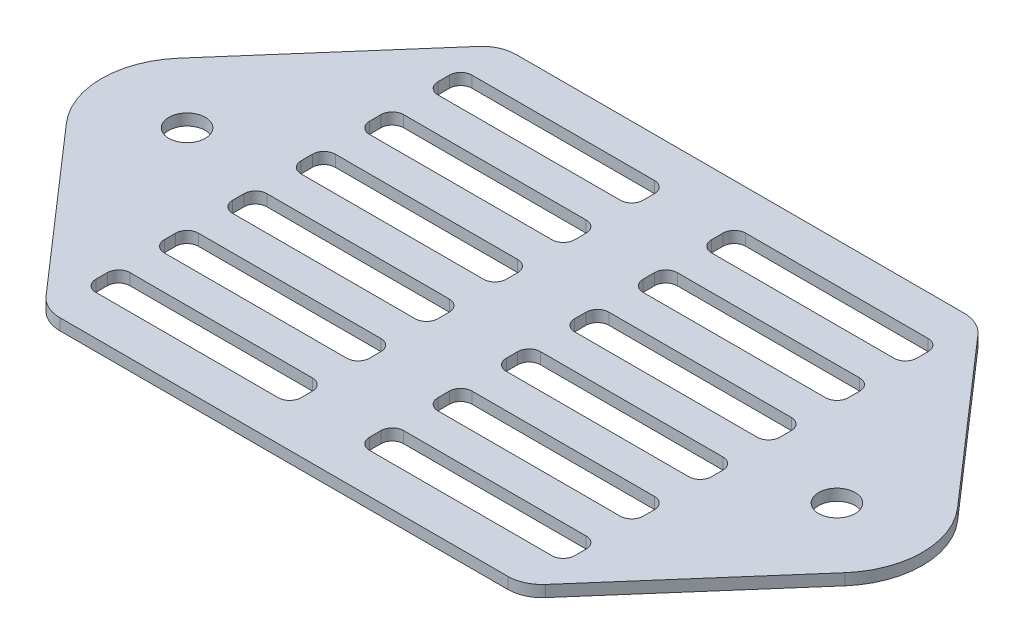
from build123d import *

# Parameters (mm, degrees)
SKETCH_1_W      = 18
SKETCH_1_H      = 3
SKETCH_1_R      = 1.6
EXTRUDE_1_DEPTH = 1
FILLET_1_R      = 3
FILLET_2_R      = 1


with BuildPart() as part:
    # 草图1 → 凸台-拉伸1 (new body)
    with BuildSketch(Plane(origin=(0, 0, 0), x_dir=(1, 0, 0), z_dir=(0, 1, 0))):
        with BuildLine():
            Line((21, 20), (-21, 20))
            Line((-21, 20), (-34.150684932, 4.931506849))
            ThreePointArc((-34.150684932, 4.931506849), (-36, 0), (-34.150684932, -4.931506849))
            Line((-34.150684932, -4.931506849), (-21, -20))
            Line((-21, -20), (21, -20))
            Line((21, -20), (34.150684932, -4.931506849))
            ThreePointArc((34.150684932, -4.931506849), (36, 0), (34.150684932, 4.931506849))
            Line((34.150684932, 4.931506849), (21, 20))
        make_face()
        with Locations((-12, -15)):
            Rectangle(SKETCH_1_W, SKETCH_1_H, mode=Mode.SUBTRACT)
        with Locations((-12, -9)):
            Rectangle(SKETCH_1_W, SKETCH_1_H, mode=Mode.SUBTRACT)
        with Locations((-12, -3)):
            Rectangle(SKETCH_1_W, SKETCH_1_H, mode=Mode.SUBTRACT)
        with Locations((12, -15)):
            Rectangle(SKETCH_1_W, SKETCH_1_H, mode=Mode.SUBTRACT)
        with Locations((12, -9)):
            Rectangle(SKETCH_1_W, SKETCH_1_H, mode=Mode.SUBTRACT)
        with Locations((12, -3)):
            Rectangle(SKETCH_1_W, SKETCH_1_H, mode=Mode.SUBTRACT)
        with Locations((-12, 3)):
            Rectangle(SKETCH_1_W, SKETCH_1_H, mode=Mode.SUBTRACT)
        with Locations((-12, 9)):
            Rectangle(SKETCH_1_W, SKETCH_1_H, mode=Mode.SUBTRACT)
        with Locations((-12, 15)):
            Rectangle(SKETCH_1_W, SKETCH_1_H, mode=Mode.SUBTRACT)
        with Locations((12, 3)):
            Rectangle(SKETCH_1_W, SKETCH_1_H, mode=Mode.SUBTRACT)
        with Locations((12, 9)):
            Rectangle(SKETCH_1_W, SKETCH_1_H, mode=Mode.SUBTRACT)
        with Locations((12, 15)):
            Rectangle(SKETCH_1_W, SKETCH_1_H, mode=Mode.SUBTRACT)
        with Locations(Location((-28.5, 0, 0), (0, 0, 270))):
            Circle(SKETCH_1_R, mode=Mode.SUBTRACT)
        with Locations(Location((28.5, 0, 0), (0, 0, 270))):
            Circle(SKETCH_1_R, mode=Mode.SUBTRACT)
    extrude(amount=EXTRUDE_1_DEPTH)

    # 圆角1
    fillet_1_edges = [part.edges().sort_by_distance(p)[0] for p in [
        (21, 0.5, 20),
        (-21, 0.5, 20),
        (-21, 0.5, -20),
        (21, 0.5, -20),
    ]]
    fillet(fillet_1_edges, radius=FILLET_1_R)

    # 圆角2
    fillet_2_edges = [part.edges().sort_by_distance(p)[0] for p in [
        (-21, 0.5, 13.5),
        (-21, 0.5, 16.5),
        (-3, 0.5, 16.5),
        (-3, 0.5, 13.5),
        (21, 0.5, 16.5),
        (21, 0.5, 13.5),
        (3, 0.5, 13.5),
        (3, 0.5, 16.5),
        (21, 0.5, 10.5),
        (21, 0.5, 7.5),
        (3, 0.5, 7.5),
        (3, 0.5, 10.5),
        (21, 0.5, 4.5),
        (21, 0.5, 1.5),
        (3, 0.5, 1.5),
        (3, 0.5, 4.5),
        (21, 0.5, -1.5),
        (21, 0.5, -4.5),
        (3, 0.5, -4.5),
        (3, 0.5, -1.5),
        (21, 0.5, -7.5),
        (21, 0.5, -10.5),
        (3, 0.5, -10.5),
        (3, 0.5, -7.5),
        (21, 0.5, -13.5),
        (21, 0.5, -16.5),
        (3, 0.5, -16.5),
        (3, 0.5, -13.5),
        (-3, 0.5, 10.5),
        (-3, 0.5, 7.5),
        (-21, 0.5, 7.5),
        (-21, 0.5, 10.5),
        (-3, 0.5, 4.5),
        (-3, 0.5, 1.5),
        (-21, 0.5, 1.5),
        (-21, 0.5, 4.5),
        (-3, 0.5, -1.5),
        (-3, 0.5, -4.5),
        (-21, 0.5, -4.5),
        (-21, 0.5, -1.5),
        (-3, 0.5, -7.5),
        (-3, 0.5, -10.5),
        (-21, 0.5, -10.5),
        (-21, 0.5, -7.5),
        (-3, 0.5, -13.5),
        (-3, 0.5, -16.5),
        (-21, 0.5, -16.5),
        (-21, 0.5, -13.5),
    ]]
    fillet(fillet_2_edges, radius=FILLET_2_R)


solid = part.part
